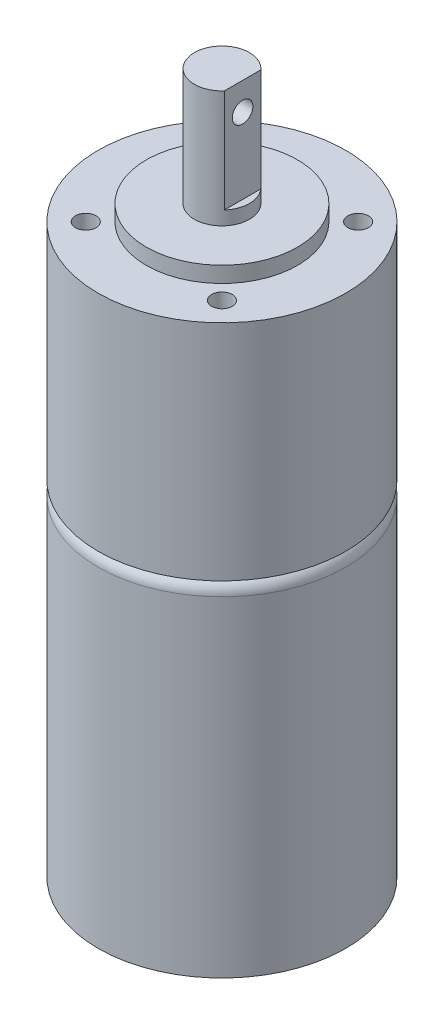
from build123d import *

# Parameters (mm, degrees)
SKETCH_3_R          = 18
EXTRUDE_1_DEPTH     = 50
FILLET_2_R          = 2
SKETCH_4_R          = 6.5
EXTRUDE_2_DEPTH     = 3
SKETCH_5_R          = 18
EXTRUDE_3_DEPTH     = 32.5
SKETCH_6_R          = 11
EXTRUDE_4_DEPTH     = 2.3
SKETCH_7_R          = 4
EXTRUDE_5_DEPTH     = 17
CUT_EXTRUDE_START   = -15
CUT_EXTRUDE_1_DEPTH = 15
SKETCH_10_R         = 1.5
CUT_EXTRUDE_2_DEPTH = 8
SKETCH_11_R         = 1.585
EXTRUDE_6_DEPTH     = 2
SKETCH_14_R         = 1.5
CUT_EXTRUDE_3_DEPTH = 7


with BuildPart() as part:
    # 草图3 → 凸台-拉伸1 (new body)
    with BuildSketch(Plane(origin=(0, 0, 0), x_dir=(1, 0, 0), z_dir=(0, 1, 0))):
        with Locations(Location((0, 0, 0), (0, 0, 270))):
            Circle(SKETCH_3_R)
    extrude(amount=EXTRUDE_1_DEPTH)

    # 圆角2
    fillet_2_edges = [part.edges().sort_by_distance(p)[0] for p in [
        (0, 50, -18),
    ]]
    fillet(fillet_2_edges, radius=FILLET_2_R)

    # 草图4 → 凸台-拉伸2 (add)
    with BuildSketch(Plane.XZ):
        with Locations(Location((0, 0, 0), (0, 0, 270))):
            Circle(SKETCH_4_R)
    extrude(amount=EXTRUDE_2_DEPTH)

    # 草图5 → 凸台-拉伸3 (add)
    with BuildSketch(Plane(origin=(0, 50, 0), x_dir=(1, 0, 0), z_dir=(0, 1, 0))):
        with Locations(Location((0, 0, 0), (0, 0, 270))):
            Circle(SKETCH_5_R)
    extrude(amount=EXTRUDE_3_DEPTH)

    # 草图6 → 凸台-拉伸4 (add)
    with BuildSketch(Plane(origin=(0, 82.5, 0), x_dir=(1, 0, 0), z_dir=(0, 1, 0))):
        with Locations(Location((0, 0, 0), (0, 0, 270))):
            Circle(SKETCH_6_R)
    extrude(amount=EXTRUDE_4_DEPTH)

    # 草图7 → 凸台-拉伸5 (add)
    with BuildSketch(Plane(origin=(0, 84.8, 0), x_dir=(1, 0, 0), z_dir=(0, 1, 0))):
        with Locations(Location((0, 0, 0), (0, 0, 270))):
            Circle(SKETCH_7_R)
    extrude(amount=EXTRUDE_5_DEPTH)

    # 草图8 → 切除-拉伸1 (cut)
    with BuildSketch(Plane(origin=(0, 101.8, 0), x_dir=(1, 0, 0), z_dir=(0, 1, 0)).offset(CUT_EXTRUDE_START)):
        with BuildLine():
            Line((3, 2.645751311), (3, -2.645751311))
            ThreePointArc((3, -2.645751311), (4, 0), (3, 2.645751311))
        make_face()
    extrude(amount=CUT_EXTRUDE_1_DEPTH, mode=Mode.SUBTRACT)

    # 草图10 → 切除-拉伸2 (cut)
    with BuildSketch(Plane(origin=(0, 82.5, 0), x_dir=(1, 0, 0), z_dir=(0, 1, 0))):
        with Locations(Location((-9.899494937, 9.899494937, 0), (0, 0, 270))):
            Circle(SKETCH_10_R)
        with Locations(Location((9.899494937, 9.899494937, 0), (0, 0, 90))):
            Circle(SKETCH_10_R)
        with Locations(Location((9.899494937, -9.899494937, 0), (0, 0, 270))):
            Circle(SKETCH_10_R)
        with Locations(Location((-9.899494937, -9.899494937, 0), (0, 0, 90))):
            Circle(SKETCH_10_R)
    extrude(amount=-CUT_EXTRUDE_2_DEPTH, mode=Mode.SUBTRACT)

    # 草图11 → 凸台-拉伸6 (add)
    with BuildSketch(Plane.XZ.offset(3)):
        with Locations(Location((0, 0, 0), (0, 0, 270))):
            Circle(SKETCH_11_R)
    extrude(amount=EXTRUDE_6_DEPTH)

    # 草图14 → 切除-拉伸3 (cut)
    with BuildSketch(Plane(origin=(3, 0, 0), x_dir=(0, 0, -1), z_dir=(1, 0, 0))):
        with Locations((0, 97.8)):
            Circle(SKETCH_14_R)
    extrude(amount=-CUT_EXTRUDE_3_DEPTH, mode=Mode.SUBTRACT)


solid = part.part
